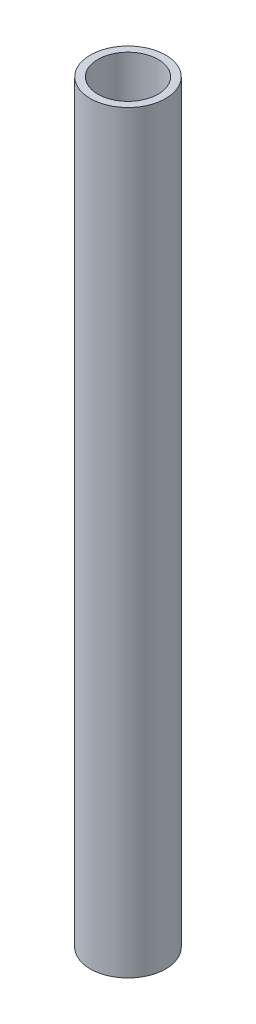
from build123d import *

# Parameters (mm, degrees)
SKETCH1_R           = 50
SKETCH1_R_2         = 40
BOSS_EXTRUDE1_DEPTH = 1000


with BuildPart() as part:
    # Sketch1 → Boss-Extrude1 (new body)
    with BuildSketch(Plane(origin=(0, 0, 0), x_dir=(1, 0, 0), z_dir=(0, 1, 0))):
        with Locations(Location((0, 0, 0), (0, 0, 270))):
            Circle(SKETCH1_R)
        with Locations(Location((0, 0, 0), (0, 0, 270))):
            Circle(SKETCH1_R_2, mode=Mode.SUBTRACT)
    extrude(amount=BOSS_EXTRUDE1_DEPTH)


solid = part.part
